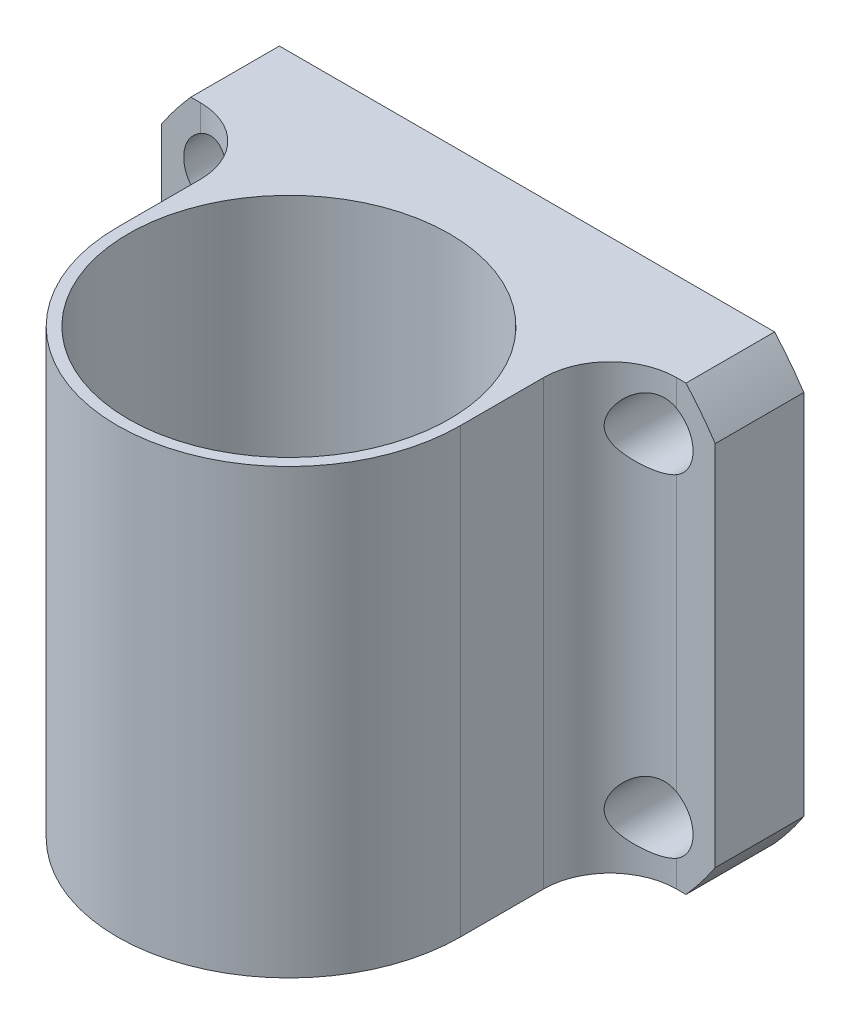
from build123d import *

# Parameters (mm, degrees)
SKETCH1_R                    = 14.5
BOSS_EXTRUDE1_DEPTH          = 20
CUT_EXTRUDE1_DEPTH           = 49.928519291
CUT_EXTRUDE1_DEPTH_BACK      = 49.928519291
SKETCH2_R                    = 3
CUT_EXTRUDE_THIN1_DEPTH      = 49.928519332
CUT_EXTRUDE_THIN1_DEPTH_BACK = 49.928519332
SKETCH5_R                    = 40
SKETCH5_R_2                  = 30


with BuildPart() as part:
    # Sketch1 → Boss-Extrude1 (new, symmetric)
    with BuildSketch(Plane(origin=(0, 0, 0), x_dir=(1, 0, 0), z_dir=(0, 1, 0))):
        with BuildLine():
            Line((-25, 21.5), (-25, 13.5))
            Line((-25, 13.5), (-21.5, 13.5))
            ThreePointArc((-21.5, 13.5), (-17.257359313, 11.742640687), (-15.5, 7.5))
            Line((-15.5, 7.5), (-15.5, 0))
            ThreePointArc((-15.5, 0), (0, -15.5), (15.5, 0))
            Line((15.5, 0), (15.5, 7.5))
            ThreePointArc((15.5, 7.5), (17.257359313, 11.742640687), (21.5, 13.5))
            Line((21.5, 13.5), (25, 13.5))
            Line((25, 13.5), (25, 21.5))
            Line((25, 21.5), (-25, 21.5))
        make_face()
        with Locations(Location((0, 0, 0), (0, 0, 270))):
            Circle(SKETCH1_R, mode=Mode.SUBTRACT)
    extrude(amount=BOSS_EXTRUDE1_DEPTH, both=True)

    # Sketch2 → Cut-Extrude1 (cut, two sides: drawn at the far end of the back side and taken through both)
    with BuildSketch(Plane(origin=(0, 0, -21.5), x_dir=(-1, 0, 0), z_dir=(0, 0, -1)).offset(-CUT_EXTRUDE1_DEPTH_BACK)):
        with Locations(Location((-20, 15, 0), (0, 0, 120))):
            Circle(SKETCH2_R)
        with Locations(Location((20, 15, 0), (0, 0, 60))):
            Circle(SKETCH2_R)
        with Locations(Location((20, -15, 0), (0, 0, 60))):
            Circle(SKETCH2_R)
        with Locations(Location((-20, -15, 0), (0, 0, 120))):
            Circle(SKETCH2_R)
    extrude(amount=CUT_EXTRUDE1_DEPTH + CUT_EXTRUDE1_DEPTH_BACK, mode=Mode.SUBTRACT)

    # Sketch5 → Cut-Extrude-Thin1 (cut, two sides: drawn at the far end of the back side and taken through both)
    with BuildSketch(Plane(origin=(0, 0, -21.5), x_dir=(-1, 0, 0), z_dir=(0, 0, -1)).offset(-CUT_EXTRUDE_THIN1_DEPTH_BACK)):
        Circle(SKETCH5_R)
        Circle(SKETCH5_R_2, mode=Mode.SUBTRACT)
    extrude(amount=CUT_EXTRUDE_THIN1_DEPTH + CUT_EXTRUDE_THIN1_DEPTH_BACK, mode=Mode.SUBTRACT)


solid = part.part
